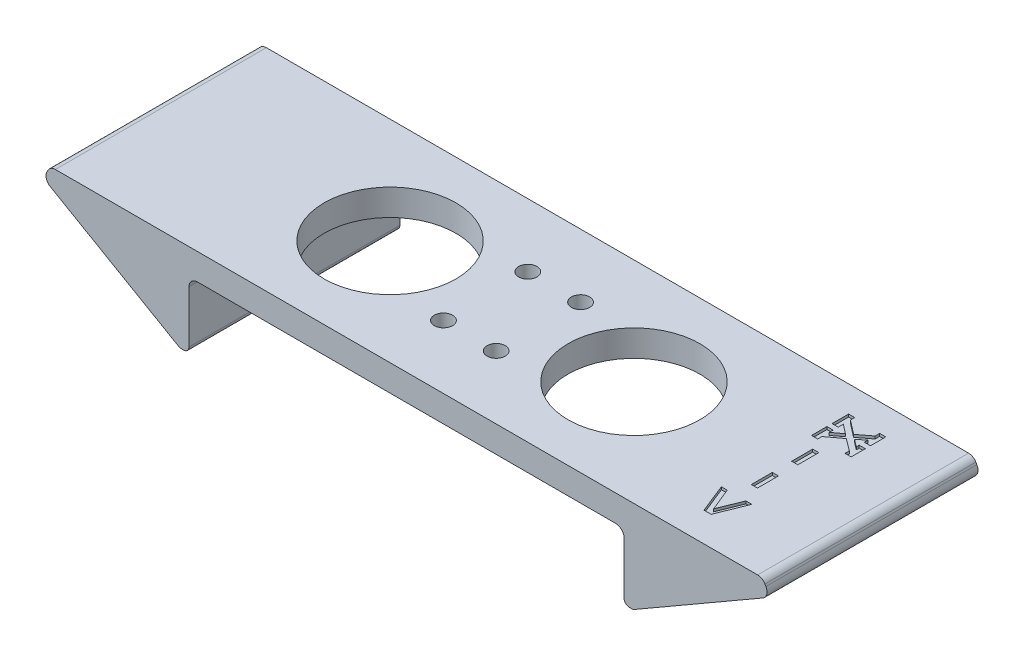
from build123d import *

# Parameters (mm, degrees)
BOSS_EXTRUDE1_DEPTH = 50.8
FILLET1_R           = 2.032
FILLET2_R           = 1.27
SKETCH2_R           = 2.1971
SKETCH2_R_2         = 15.875
CUT_EXTRUDE1_DEPTH  = 104.011248837
SKETCH3_W           = 1.47561847
SKETCH3_H           = 5.061923893
CUT_EXTRUDE2_DEPTH  = 0.635


with BuildPart() as part:
    # Sketch1 → Boss-Extrude1 (new body)
    with BuildSketch(Plane.XY):
        Polygon((85.725, 0), (-85.725, 0), (-87.558087105, -3.175), (-54.56251922, -22.225), (-52.3875, -22.225), (-52.3875, -6.35), (52.3875, -6.35), (52.3875, -22.225), (54.56251922, -22.225), (87.558087105, -3.175), align=None)
    extrude(amount=BOSS_EXTRUDE1_DEPTH)

    # Fillet1
    fillet1_edges = [part.edges().sort_by_distance(p)[0] for p in [
        (-85.725, 0, 25.4),
        (85.725, 0, 25.4),
        (87.558087105, -3.175, 25.4),
        (52.3875, -6.35, 25.4),
        (-52.3875, -6.35, 25.4),
        (-87.558087105, -3.175, 25.4),
    ]]
    fillet(fillet1_edges, radius=FILLET1_R)

    # Fillet2
    fillet2_edges = [part.edges().sort_by_distance(p)[0] for p in [
        (54.56251922, -22.225, 25.4),
        (52.3875, -22.225, 25.4),
        (-52.3875, -22.225, 25.4),
        (-54.56251922, -22.225, 25.4),
    ]]
    fillet(fillet2_edges, radius=FILLET2_R)

    # Sketch2 → Cut-Extrude1 (cut, through all)
    with BuildSketch(Plane(origin=(0, 0, 0), x_dir=(1, 0, 0), z_dir=(0, 1, 0))):
        with Locations(Location((6.35, -35.56, 0), (0, 0, 180))):
            Circle(SKETCH2_R)
        with Locations(Location((-6.35, -35.56, 0), (0, 0, 180))):
            Circle(SKETCH2_R)
        with Locations(Location((-6.35, -15.24, 0), (0, 0, 180))):
            Circle(SKETCH2_R)
        with Locations(Location((6.35, -15.24, 0), (0, 0, 180))):
            Circle(SKETCH2_R)
        with Locations(Location((29.36875, -25.4, 0), (0, 0, 180))):
            Circle(SKETCH2_R_2)
        with Locations(Location((-29.36875, -25.4, 0), (0, 0, 180))):
            Circle(SKETCH2_R_2)
    extrude(amount=-CUT_EXTRUDE1_DEPTH, mode=Mode.SUBTRACT)

    # Sketch3 → Cut-Extrude2 (cut)
    with BuildSketch(Plane(origin=(0, 0, 0), x_dir=(1, 0, 0), z_dir=(0, 1, 0))):
        Polygon((61.952737106, -15.22945322), (63.428353296, -15.22945322), (63.428353296, -14.204150233), (66.787671186, -11.688640612), (69.723065901, -13.881379712), (69.723065901, -14.930594244), (71.198684372, -14.930594244), (71.198684372, -11.512394715), (69.723065901, -11.512394715), (69.723065901, -12.211960755), (67.929186974, -10.847171738), (69.723065901, -9.442854683), (69.723065901, -10.284273394), (71.198684372, -10.284273394), (71.198684372, -6.595230639), (69.723065901, -6.595230639), (69.723065901, -7.679269337), (66.787671186, -9.928245145), (63.428353296, -7.333914297), (63.428353296, -6.296371664), (61.952737106, -6.296371664), (61.952737106, -10.284273394), (63.428353296, -10.284273394), (63.428353296, -9.052344284), (65.662462767, -10.778941636), (63.428353296, -12.473735972), (63.428353296, -11.512394715), (61.952737106, -11.512394715), align=None)
        with Locations((65.679133813, -20.468824629)):
            Rectangle(SKETCH3_W, SKETCH3_H)
        with Locations((65.679133813, -30.181741323)):
            Rectangle(SKETCH3_W, SKETCH3_H)
        Polygon((64.586217495, -43.756476338), (66.339613015, -43.756476338), (69.106673825, -36.779987136), (67.706939797, -36.779987136), (65.470958353, -42.299591277), (63.202804515, -36.779987136), (61.803305338, -36.779987136), align=None)
    extrude(amount=-CUT_EXTRUDE2_DEPTH, mode=Mode.SUBTRACT)


solid = part.part
